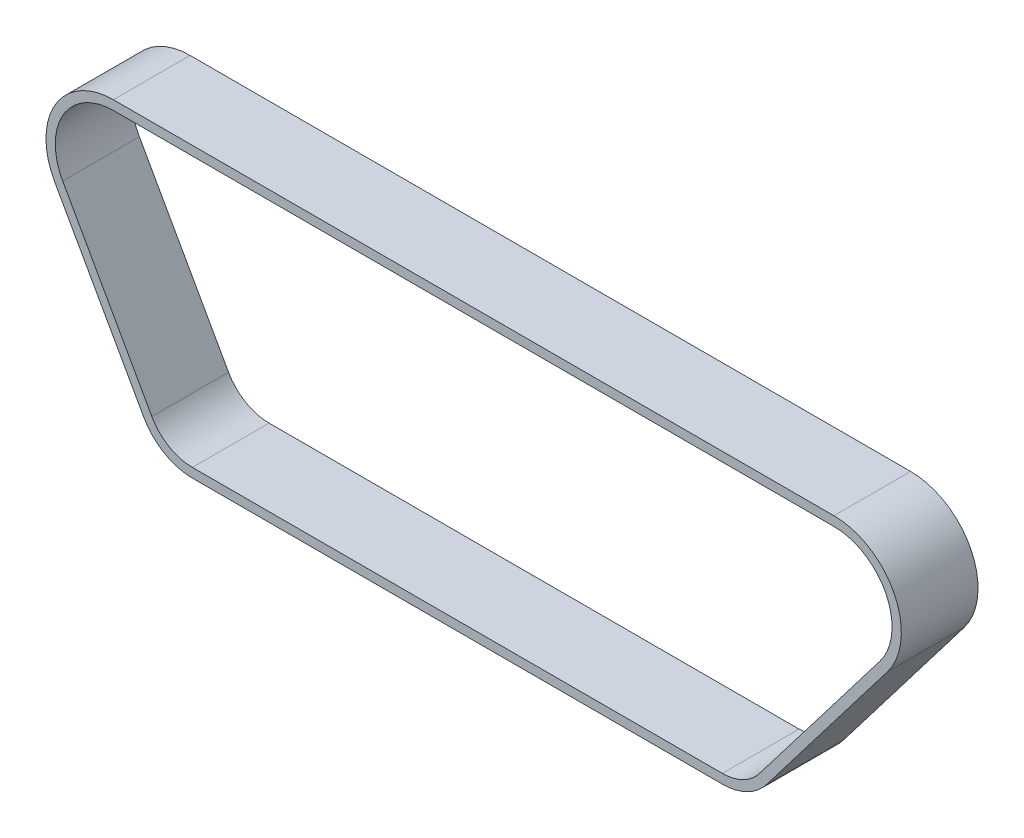
from build123d import *

# Parameters (mm, degrees)
BOSS_EXTRUDE1_DEPTH = 8.25


with BuildPart() as part:
    # Sketch1 → Boss-Extrude1 (new, symmetric)
    with BuildSketch(Plane.XY):
        with BuildLine():
            Line((-138, -47.5), (-24, -47.5))
            ThreePointArc((-24, -47.5), (-18.683662323, -46.258092475), (-14.467724607, -42.789425618))
            Line((-14.467724607, -42.789425618), (11.5181661, -8.808055955))
            ThreePointArc((11.5181661, -8.808055955), (12.999361741, 6.423908026), (0, 14.5))
            Line((0, 14.5), (-155, 14.5))
            ThreePointArc((-155, 14.5), (-167.508377087, 7.334200888), (-167.653648321, -7.080620323))
            Line((-167.653648321, -7.080620323), (-148.471984818, -41.359823716))
            ThreePointArc((-148.471984818, -41.359823716), (-144.069683493, -45.851760348), (-138, -47.5))
        make_face()
        with BuildLine():
            Line((-155, 12.5), (0, 12.5))
            ThreePointArc((0, 12.5), (11.206346328, 5.537851747), (9.929453534, -7.593151685))
            Line((9.929453534, -7.593151685), (-16.056437173, -41.574521348))
            ThreePointArc((-16.056437173, -41.574521348), (-19.569718603, -44.465077063), (-24, -45.5))
            Line((-24, -45.5), (-138, -45.5))
            ThreePointArc((-138, -45.5), (-143.058069578, -44.126466956), (-146.726654015, -40.38318643))
            Line((-146.726654015, -40.38318643), (-165.908317518, -6.103983037))
            ThreePointArc((-165.908317518, -6.103983037), (-165.783083695, 6.322586972), (-155, 12.5))
        make_face(mode=Mode.SUBTRACT)
    extrude(amount=BOSS_EXTRUDE1_DEPTH, both=True)


solid = part.part
